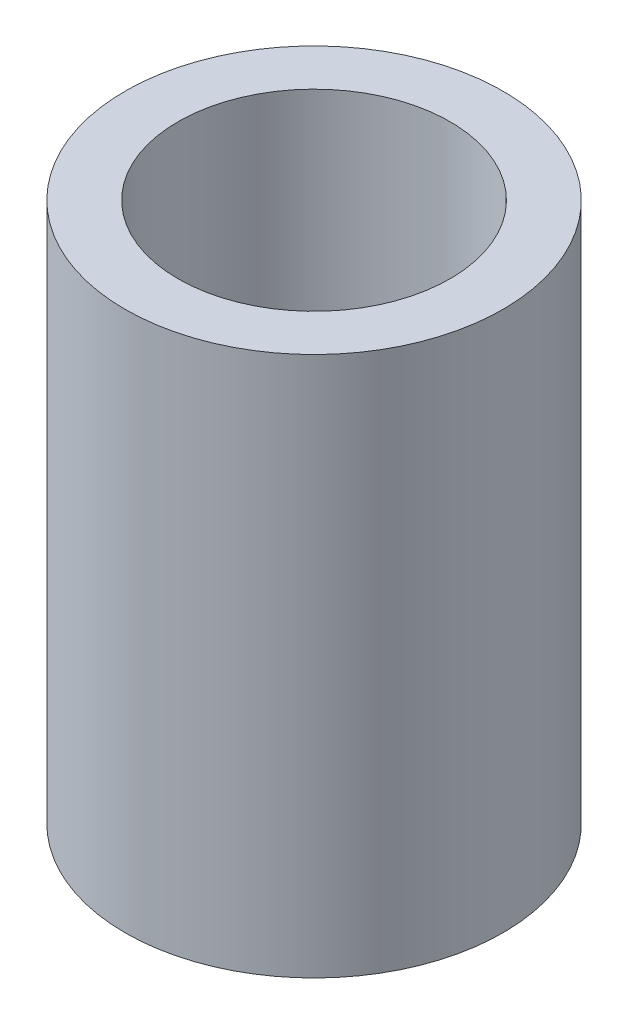
from build123d import *

# Parameters (mm, degrees)
SKETCH1_R           = 4.445
SKETCH1_R_2         = 3.2004
BOSS_EXTRUDE1_DEPTH = 6.35


with BuildPart() as part:
    # Sketch1 → Boss-Extrude1 (new, symmetric)
    with BuildSketch(Plane(origin=(0, 0, 0), x_dir=(1, 0, 0), z_dir=(0, 1, 0))):
        with Locations(Location((0, 0, 0), (0, 0, 270))):
            Circle(SKETCH1_R)
        with Locations(Location((0, 0, 0), (0, 0, 270))):
            Circle(SKETCH1_R_2, mode=Mode.SUBTRACT)
    extrude(amount=BOSS_EXTRUDE1_DEPTH, both=True)


solid = part.part
